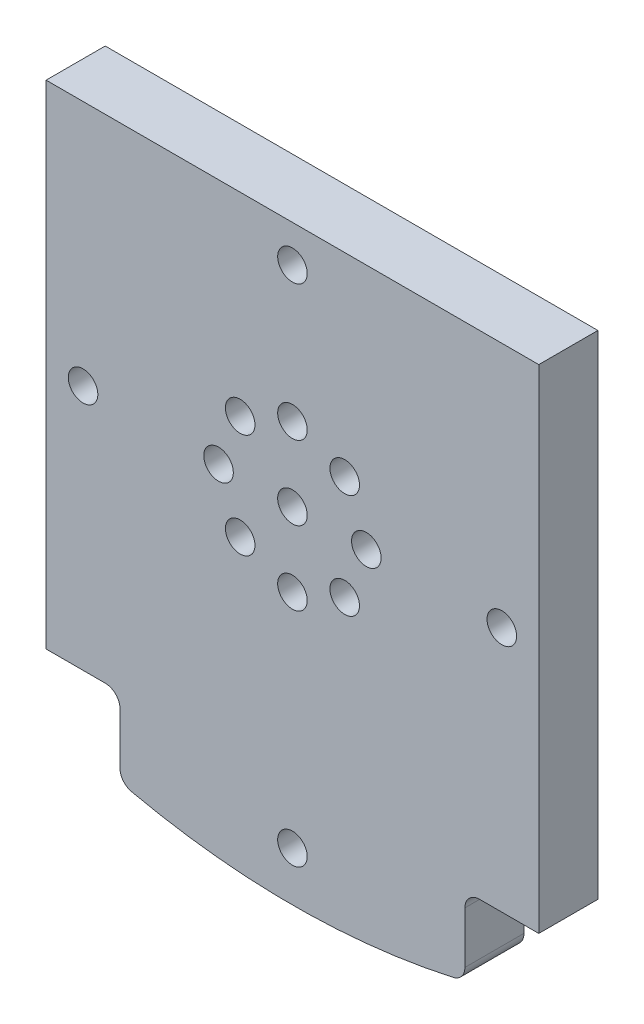
from build123d import *

# Parameters (mm, degrees)
SKETCH_1_R          = 3
EXTRUDE_1_DEPTH     = 12
SKETCH_3_R          = 5.5
CUT_EXTRUDE_2_DEPTH = 6


with BuildPart() as part:
    # 草图1 → 凸台-拉伸1 (new body)
    with BuildSketch(Plane.XY):
        with BuildLine():
            Line((-35, -53), (-35, -63.474736452))
            ThreePointArc((-35, -63.474736452), (-34.340852801, -65.351011529), (-32.653061224, -66.402792298))
            ThreePointArc((-32.653061224, -66.402792298), (0, -70), (32.653061224, -66.402792298))
            ThreePointArc((32.653061224, -66.402792298), (34.340852801, -65.351011529), (35, -63.474736452))
            Line((35, -63.474736452), (35, -53))
            ThreePointArc((35, -53), (35.878679656, -50.878679656), (38, -50))
            Line((38, -50), (50, -50))
            Line((50, -50), (50, 50))
            Line((50, 50), (0, 50))
            Line((0, 50), (-50, 50))
            Line((-50, 50), (-50, -50))
            Line((-50, -50), (-38, -50))
            ThreePointArc((-38, -50), (-35.878679656, -50.878679656), (-35, -53))
        make_face()
        with Locations((-42.5, 0)):
            Circle(SKETCH_1_R, mode=Mode.SUBTRACT)
        with Locations((42.5, 0)):
            Circle(SKETCH_1_R, mode=Mode.SUBTRACT)
        with Locations((0, -60)):
            Circle(SKETCH_1_R, mode=Mode.SUBTRACT)
        Circle(SKETCH_1_R, mode=Mode.SUBTRACT)
        with Locations((0, 42.5)):
            Circle(SKETCH_1_R, mode=Mode.SUBTRACT)
        with Locations((15, 0)):
            Circle(SKETCH_1_R, mode=Mode.SUBTRACT)
        with Locations((10.606601718, -10.606601718)):
            Circle(SKETCH_1_R, mode=Mode.SUBTRACT)
        with Locations((0, -15)):
            Circle(SKETCH_1_R, mode=Mode.SUBTRACT)
        with Locations((-10.606601718, -10.606601718)):
            Circle(SKETCH_1_R, mode=Mode.SUBTRACT)
        with Locations((-15, 0)):
            Circle(SKETCH_1_R, mode=Mode.SUBTRACT)
        with Locations((-10.606601718, 10.606601718)):
            Circle(SKETCH_1_R, mode=Mode.SUBTRACT)
        with Locations((0, 15)):
            Circle(SKETCH_1_R, mode=Mode.SUBTRACT)
        with Locations((10.606601718, 10.606601718)):
            Circle(SKETCH_1_R, mode=Mode.SUBTRACT)
    extrude(amount=EXTRUDE_1_DEPTH)

    # 草图3 → 切除-拉伸2 (cut)
    with BuildSketch(Plane(origin=(0, 0, 0), x_dir=(-1, 0, 0), z_dir=(0, 0, -1))):
        with Locations((0, -60)):
            Circle(SKETCH_3_R)
    extrude(amount=-CUT_EXTRUDE_2_DEPTH, mode=Mode.SUBTRACT)


solid = part.part
